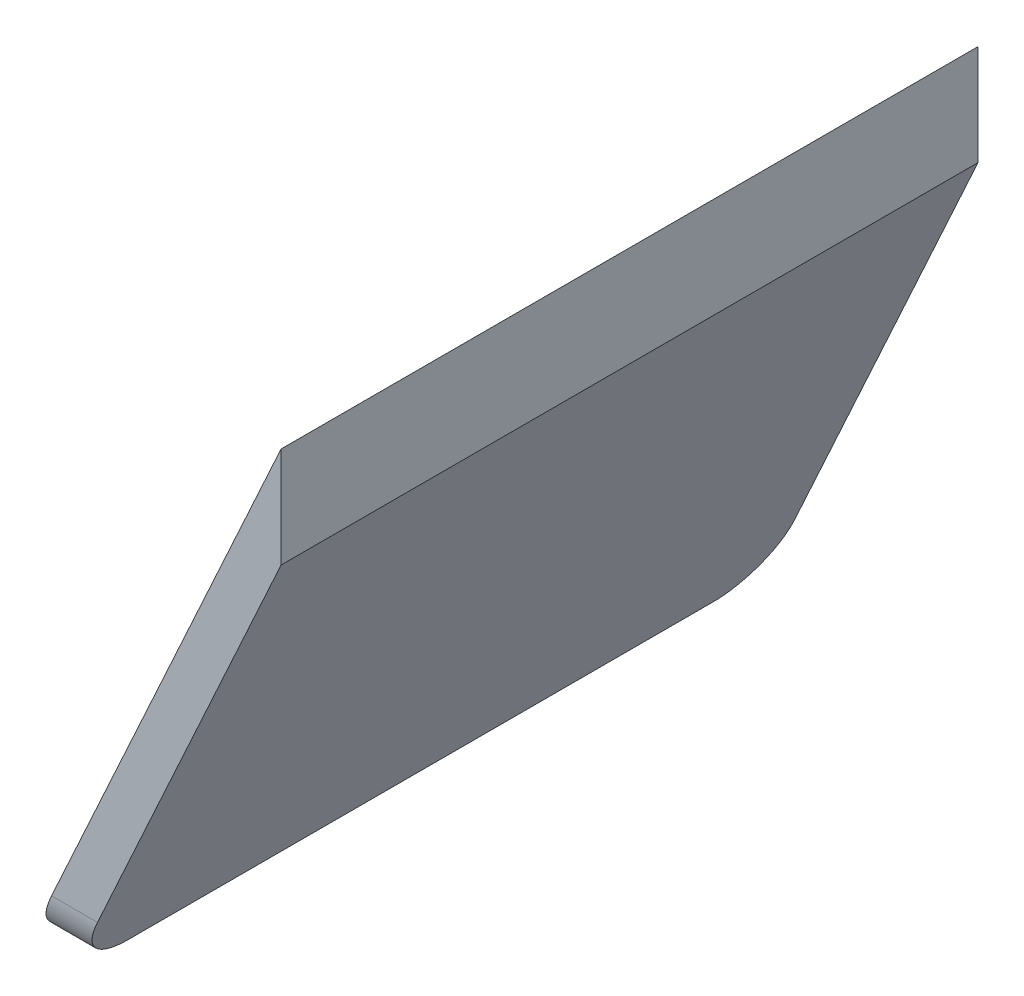
from build123d import *

# Parameters (mm, degrees)
BOSS_EXTRUDE1_DEPTH = 50
FILLET1_R           = 4
CUT_EXTRUDE1_DEPTH  = 1.5


with BuildPart() as part:
    # Sketch1 → Boss-Extrude1 (new body)
    with BuildSketch(Plane.XY):
        Polygon((0, 0), (15, 32.788635103), (15, 40), (-3.299023369, 0), align=None)
    extrude(amount=BOSS_EXTRUDE1_DEPTH)

    # Fillet1
    fillet1_edges = [part.edges().sort_by_distance(p)[0] for p in [
        (-1.649511685, 0, 50),
        (-1.649511685, 0, 0),
    ]]
    fillet(fillet1_edges, radius=FILLET1_R)

    # Sketch2 → Cut-Extrude1 (cut)
    with BuildSketch(Plane(origin=(-2.728080099, 1.248030037, 0), x_dir=(0, 0, 1), z_dir=(-0.9093600329934255, 0.4160100123725345, 0))):
        Polygon((20, 12.820411289), (30, 12.820411289), (34.5, 16.820411289), (34.5, 26.820411289), (36.5, 26.820411289), (36.5, 32.820411289), (26, 32.820411289), (26, 26.820411289), (28, 26.820411289), (28, 18.820411289), (22, 18.820411289), (22, 26.820411289), (24, 26.820411289), (24, 32.820411289), (13.5, 32.820411289), (13.5, 26.820411289), (15.5, 26.820411289), (15.5, 16.820411289), align=None)
    extrude(amount=-CUT_EXTRUDE1_DEPTH, mode=Mode.SUBTRACT)


solid = part.part
